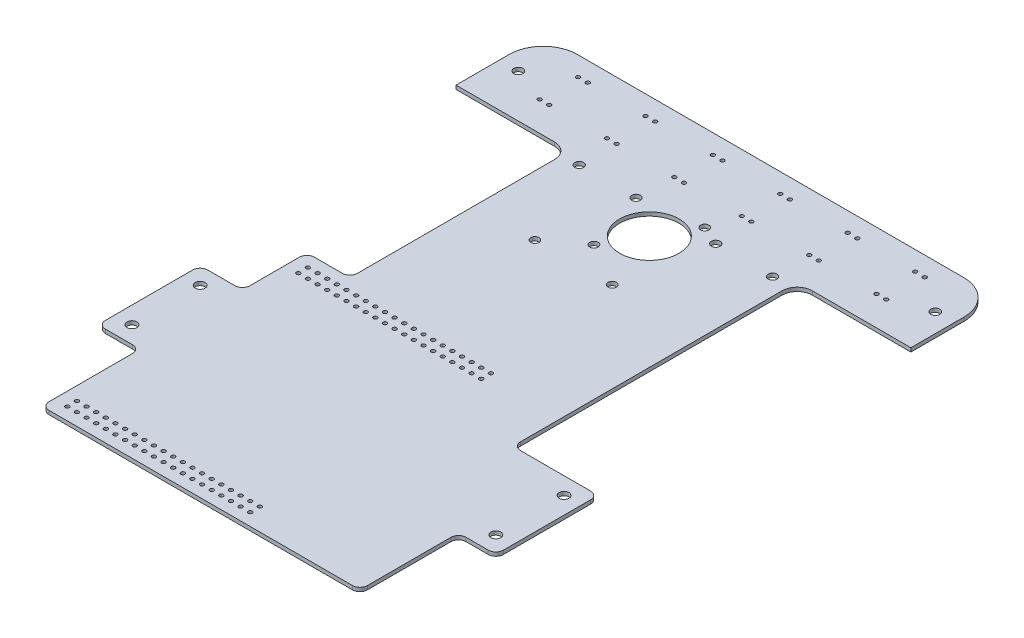
from build123d import *

# Parameters (mm, degrees)
BOSS_EXTRUDE1_DEPTH  = 0.5
M2_CLEARANCE_HOLE1_D = 2.6
FILLET1_R            = 2
FILLET2_R            = 9
M2_CLEARANCE_HOLE2_D = 2.4
FILLET4_R            = 2
FILLET5_R            = 4
M2_CLEARANCE_HOLE3_D = 2.2
SKETCH17_R           = 1.15
CUT_EXTRUDE6_DEPTH   = 163.486922551
CUT_EXTRUDE7_REACH   = 164.487
SKETCH18_R           = 7.85
M2_CLEARANCE_HOLE4_D = 2.2
CUT_EXTRUDE8_REACH   = 164.487
SKETCH21_R           = 0.51
LPATTERN1_COUNT      = 2
LPATTERN1_PITCH      = 2.54
LPATTERN1_COUNT_DIR2 = 20
LPATTERN1_PITCH_DIR2 = 2.54
CUT_EXTRUDE9_REACH   = 164.487
SKETCH22_R           = 0.51
LPATTERN2_COUNT      = 2
LPATTERN2_PITCH      = 10.16
LPATTERN2_COUNT_DIR2 = 6
LPATTERN2_PITCH_DIR2 = 17.78


with BuildPart() as part:
    # Sketch1 → Boss-Extrude1 (new, symmetric)
    with BuildSketch(Plane(origin=(0, 0, 0), x_dir=(1, 0, 0), z_dir=(0, 1, 0))):
        Polygon((-52.5, -125), (-41.35, -125), (-41.35, -151), (42.65, -151), (42.65, -125), (52.5, -125), (52.5, -98), (30, -98), (30, -23), (60, -23), (60, 0), (-60, 0), (-60, -23), (-30, -23), (-30, -81), (-41.35, -81), (-41.35, -98), (-52.5, -98), align=None)
    extrude(amount=BOSS_EXTRUDE1_DEPTH, both=True)

    # M2 Clearance Hole1 (through all)
    with Locations(Plane(origin=(0, 0.5, 0), x_dir=(1, 0, 0), z_dir=(0, 1, 0))):
        with Locations((-48, -120.5), (48, -120.5), (-48, -102.5), (48, -102.5)):
            Hole(M2_CLEARANCE_HOLE1_D / 2)

    # Fillet1
    fillet1_edges = [part.edges().sort_by_distance(p)[0] for p in [
        (-52.5, 0, 98),
        (-41.35, 0, 81),
        (52.5, 0, 98),
        (52.5, 0, 125),
        (42.65, 0, 151),
        (-41.35, 0, 151),
        (-52.5, 0, 125),
    ]]
    fillet(fillet1_edges, radius=FILLET1_R)

    # Fillet2
    fillet2_edges = [part.edges().sort_by_distance(p)[0] for p in [
        (-60, 0, 0),
        (60, 0, 0),
    ]]
    fillet(fillet2_edges, radius=FILLET2_R)

    # M2 Clearance Hole2 (through all)
    with Locations(Plane(origin=(0, 0.5, 0), x_dir=(1, 0, 0), z_dir=(0, 1, 0))):
        with Locations((-55, -11.57), (55, -11.57)):
            Hole(M2_CLEARANCE_HOLE2_D / 2)

    # Fillet4
    fillet4_edges = [part.edges().sort_by_distance(p)[0] for p in [
        (-41.35, 0, 98),
        (-30, 0, 81),
        (30, 0, 98),
        (42.65, 0, 125),
        (-41.35, 0, 125),
    ]]
    fillet(fillet4_edges, radius=FILLET4_R)

    # Fillet5
    fillet5_edges = [part.edges().sort_by_distance(p)[0] for p in [
        (-30, 0, 23),
        (30, 0, 23),
    ]]
    fillet(fillet5_edges, radius=FILLET5_R)

    # M2 Clearance Hole3 (through all)
    with Locations(Plane(origin=(0, 0.5, 0), x_dir=(1, 0, 0), z_dir=(0, 1, 0))):
        with Locations((5.35, -22.73352818), (-5.35, -41.26647182)):
            Hole(M2_CLEARANCE_HOLE3_D / 2)

    # Sketch17 → Cut-Extrude6 (cut, through all)
    with BuildSketch(Plane(origin=(0, 0.5, 0), x_dir=(1, 0, 0), z_dir=(0, 1, 0))):
        with Locations(Location((25.5, -25, 0), (0, 0, 270))):
            Circle(SKETCH17_R)
        with Locations(Location((10.5, -25, 0), (0, 0, 270))):
            Circle(SKETCH17_R)
        with Locations(Location((-10.5, -25, 0), (0, 0, 270))):
            Circle(SKETCH17_R)
        with Locations(Location((-25.5, -25, 0), (0, 0, 270))):
            Circle(SKETCH17_R)
    extrude(amount=-CUT_EXTRUDE6_DEPTH, mode=Mode.SUBTRACT)

    # Sketch18 → Cut-Extrude7 (cut, up to next)
    with BuildSketch(Plane(origin=(0, 0.5, 0), x_dir=(1, 0, 0), z_dir=(0, 1, 0)), mode=Mode.PRIVATE) as cut_extrude7_sk1:
        with Locations(Location((0, -32, 0), (0, 0, 270))):
            Circle(SKETCH18_R)
    cut_extrude7_tool1 = extrude(cut_extrude7_sk1.sketch, amount=-CUT_EXTRUDE7_REACH, mode=Mode.PRIVATE) & part.part
    add(cut_extrude7_tool1.solids().sort_by_distance((0, 0.5, 32))[0], mode=Mode.SUBTRACT)

    # M2 Clearance Hole4 (through all)
    with Locations(Plane(origin=(0, 0.5, 0), x_dir=(1, 0, 0), z_dir=(0, 1, 0))):
        with Locations((-14.21, -48), (6.21, -48)):
            Hole(M2_CLEARANCE_HOLE4_D / 2)

    # Sketch21 → Cut-Extrude8 (cut, up to next)
    with BuildSketch(Plane(origin=(0, 0.5, 0), x_dir=(1, 0, 0), z_dir=(0, 1, 0)), mode=Mode.PRIVATE) as cut_extrude8_sk1:
        with Locations(Location((-37.826, -147.73, 0), (0, 0, 270))):
            Circle(SKETCH21_R)
    cut_extrude8_tool1 = extrude(cut_extrude8_sk1.sketch, amount=-CUT_EXTRUDE8_REACH, mode=Mode.PRIVATE) & part.part
    # Sketch21 → Cut-Extrude8 (cut, up to next)
    with BuildSketch(Plane(origin=(0, 0.5, 0), x_dir=(1, 0, 0), z_dir=(0, 1, 0)), mode=Mode.PRIVATE) as cut_extrude8_sk2:
        with Locations(Location((-37.826, -86.7798, 0), (0, 0, 270))):
            Circle(SKETCH21_R)
    cut_extrude8_tool2 = extrude(cut_extrude8_sk2.sketch, amount=-CUT_EXTRUDE8_REACH, mode=Mode.PRIVATE) & part.part
    cut_extrude8_1 = cut_extrude8_tool1.solids().sort_by_distance((-37.826, 0.5, 147.73))[0]
    add(cut_extrude8_1, mode=Mode.SUBTRACT)
    cut_extrude8_2 = cut_extrude8_tool2.solids().sort_by_distance((-37.826, 0.5, 86.7798))[0]
    add(cut_extrude8_2, mode=Mode.SUBTRACT)
    cut_extrude8 = cut_extrude8_1 + cut_extrude8_2  # Cut-Extrude8 as one shape, for the pattern or mirror that repeats it

    # LPattern1: Cut-Extrude8 2 × 20
    with Locations(*[(j * LPATTERN1_PITCH_DIR2, 0, -i * LPATTERN1_PITCH) for i in range(LPATTERN1_COUNT) for j in range(LPATTERN1_COUNT_DIR2) if (i, j) != (0, 0)]):
        add(cut_extrude8, mode=Mode.SUBTRACT)

    # Sketch22 → Cut-Extrude9 (cut, up to next)
    with BuildSketch(Plane(origin=(0, 0.5, 0), x_dir=(1, 0, 0), z_dir=(0, 1, 0)), mode=Mode.PRIVATE) as cut_extrude9_sk1:
        with Locations(Location((-45.72, -5.08, 0), (0, 0, 270))):
            Circle(SKETCH22_R)
    cut_extrude9_tool1 = extrude(cut_extrude9_sk1.sketch, amount=-CUT_EXTRUDE9_REACH, mode=Mode.PRIVATE) & part.part
    # Sketch22 → Cut-Extrude9 (cut, up to next)
    with BuildSketch(Plane(origin=(0, 0.5, 0), x_dir=(1, 0, 0), z_dir=(0, 1, 0)), mode=Mode.PRIVATE) as cut_extrude9_sk2:
        with Locations(Location((-43.18, -5.08, 0), (0, 0, 270))):
            Circle(SKETCH22_R)
    cut_extrude9_tool2 = extrude(cut_extrude9_sk2.sketch, amount=-CUT_EXTRUDE9_REACH, mode=Mode.PRIVATE) & part.part
    cut_extrude9_1 = cut_extrude9_tool1.solids().sort_by_distance((-45.72, 0.5, 5.08))[0]
    add(cut_extrude9_1, mode=Mode.SUBTRACT)
    cut_extrude9_2 = cut_extrude9_tool2.solids().sort_by_distance((-43.18, 0.5, 5.08))[0]
    add(cut_extrude9_2, mode=Mode.SUBTRACT)
    cut_extrude9 = cut_extrude9_1 + cut_extrude9_2  # Cut-Extrude9 as one shape, for the pattern or mirror that repeats it

    # LPattern2: Cut-Extrude9 2 × 6
    with Locations(*[(j * LPATTERN2_PITCH_DIR2, 0, i * LPATTERN2_PITCH) for i in range(LPATTERN2_COUNT) for j in range(LPATTERN2_COUNT_DIR2) if (i, j) != (0, 0)]):
        add(cut_extrude9, mode=Mode.SUBTRACT)


solid = part.part
